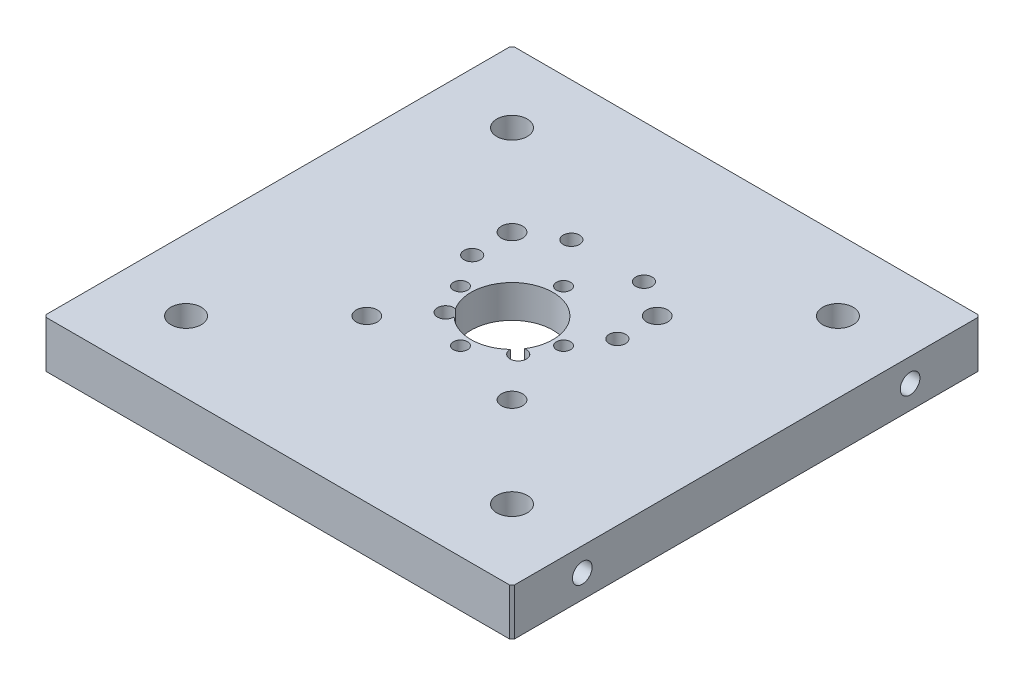
from build123d import *

# Parameters (mm, degrees)
BOSS_EXTRUDE1_DEPTH                  = 5
BOSS_EXTRUDE1_DEPTH_BACK             = 5
SKETCH1_W                            = 100
SKETCH1_H                            = 100
SKETCH2_R                            = 8.75
SKETCH2_R_2                          = 3.25
CUT_EXTRUDE1_DEPTH                   = 12.7
TAP_DRILL_FOR_M5X0_8_TAP1_AT_2_COUNT = 2
TAP_DRILL_FOR_M5X0_8_TAP1_AT_2_PITCH = 70
SKETCH11_R                           = 37.5
CUT_EXTRUDE2_DEPTH                   = 3
CHAMFER1_SIZE                        = 0.5
SKETCH12_R                           = 1.75
CUT_EXTRUDE3_DEPTH                   = 72.414284285
SKETCH13_R                           = 2.25
CUT_EXTRUDE4_DEPTH                   = 10
SKETCH14_R                           = 1.5
CUT_EXTRUDE5_DEPTH                   = 10


with BuildPart() as part:
    # Sketch1 → Boss-Extrude1 (new, two sides: drawn at the far end of the back side and taken through both)
    with BuildSketch(Plane(origin=(0, 0, 0), x_dir=(1, 0, 0), z_dir=(0, 1, 0)).offset(-BOSS_EXTRUDE1_DEPTH_BACK)):
        Rectangle(SKETCH1_W, SKETCH1_H)
    extrude(amount=BOSS_EXTRUDE1_DEPTH + BOSS_EXTRUDE1_DEPTH_BACK)

    # Sketch2 → Cut-Extrude1 (cut)
    with BuildSketch(Plane(origin=(0, 5, 0), x_dir=(1, 0, 0), z_dir=(0, 1, 0))):
        Circle(SKETCH2_R)
        with Locations((-34.798492469, 34.798492469)):
            Circle(SKETCH2_R_2)
        with Locations((34.798492469, 34.798492469)):
            Circle(SKETCH2_R_2)
        with Locations((34.798492469, -34.798492469)):
            Circle(SKETCH2_R_2)
        with Locations((-34.798492469, -34.798492469)):
            Circle(SKETCH2_R_2)
    extrude(amount=-CUT_EXTRUDE1_DEPTH, mode=Mode.SUBTRACT)

    # Sketch10 → Tap Drill for M5x0.8 Tap1 (revolve, cut)
    with BuildSketch(Plane(origin=(-50, 0, -35), x_dir=(0, 0, 1), z_dir=(0, 1, 0))):
        Polygon((0, 0), (0, 11.2618073), (2.1, 10), (2.1, 0), align=None)
    tap_drill_for_m5x0_8_tap1 = revolve(axis=Axis((-56.35, 0, -35), (1, 0, 0)), mode=Mode.SUBTRACT)

    # Tap Drill for M5x0.8 Tap1 at 2: Tap Drill for M5x0.8 Tap1 ×2
    with Locations(*[(0, 0, i * TAP_DRILL_FOR_M5X0_8_TAP1_AT_2_PITCH) for i in range(1, TAP_DRILL_FOR_M5X0_8_TAP1_AT_2_COUNT)]):
        add(tap_drill_for_m5x0_8_tap1, mode=Mode.SUBTRACT)

    # Sketch11 → Cut-Extrude2 (cut)
    with BuildSketch(Plane.XZ.offset(5)):
        Circle(SKETCH11_R)
    extrude(amount=-CUT_EXTRUDE2_DEPTH, mode=Mode.SUBTRACT)

    # Chamfer1
    chamfer1_edges = [part.edges().sort_by_distance(p)[0] for p in [
        (50, 0, -50),
        (50, 0, 50),
        (-50, 0, 50),
        (-50, 0, -50),
    ]]
    chamfer(chamfer1_edges, length=CHAMFER1_SIZE)

    # Mirror1: Tap Drill for M5x0.8 Tap1 across plane
    add(tap_drill_for_m5x0_8_tap1.mirror(Plane.ZY), mode=Mode.SUBTRACT)

    # Mirror1 copy 1 sketch → Mirror1 copy 1 (revolve, cut)
    with BuildSketch(Plane(origin=(50, 0, 35), x_dir=(0, 0, 1), z_dir=(0, 1, 0))):
        Polygon((0, 0), (0, -11.2618073), (2.1, -10), (2.1, 0), align=None)
    revolve(axis=Axis((56.35, 0, 35), (1, 0, 0)), mode=Mode.SUBTRACT)

    # Sketch12 → Cut-Extrude3 (cut, through all)
    with BuildSketch(Plane(origin=(0, 5, 0), x_dir=(1, 0, 0), z_dir=(0, 1, 0))):
        with Locations((-15.5, 7)):
            Circle(SKETCH12_R)
        with Locations((15.5, 7)):
            Circle(SKETCH12_R)
        with Locations((-7.75, 20.423393759)):
            Circle(SKETCH12_R)
        with Locations((7.75, 20.423393759)):
            Circle(SKETCH12_R)
        with Locations((7.75, -6.423393759)):
            Circle(SKETCH12_R)
        with Locations((-7.75, -6.423393759)):
            Circle(SKETCH12_R)
    extrude(amount=-CUT_EXTRUDE3_DEPTH, mode=Mode.SUBTRACT)

    # Sketch13 → Cut-Extrude4 (cut)
    with BuildSketch(Plane(origin=(0, 5, 0), x_dir=(1, 0, 0), z_dir=(0, 1, 0))):
        with Locations((-15.5, -15.5)):
            Circle(SKETCH13_R)
        with Locations((-15.5, 15.5)):
            Circle(SKETCH13_R)
        with Locations((15.5, 15.5)):
            Circle(SKETCH13_R)
        with Locations((15.5, -15.5)):
            Circle(SKETCH13_R)
    extrude(amount=-CUT_EXTRUDE4_DEPTH, mode=Mode.SUBTRACT)

    # Sketch14 → Cut-Extrude5 (cut)
    with BuildSketch(Plane(origin=(0, 5, 0), x_dir=(1, 0, 0), z_dir=(0, 1, 0))):
        with Locations((0, 11)):
            Circle(SKETCH14_R)
        with Locations((-11, 0)):
            Circle(SKETCH14_R)
        with Locations((0, -11)):
            Circle(SKETCH14_R)
        with Locations((11, 0)):
            Circle(SKETCH14_R)
    extrude(amount=-CUT_EXTRUDE5_DEPTH, mode=Mode.SUBTRACT)


solid = part.part
